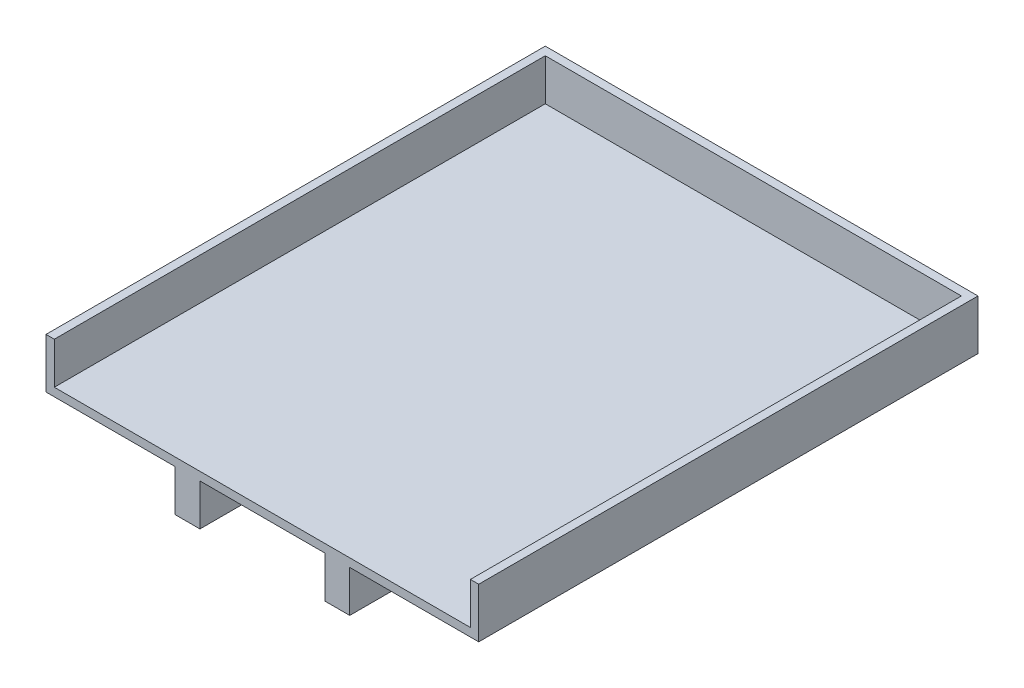
from build123d import *

# Parameters (mm, degrees)
BOSS_EXTRUDE1_DEPTH = 60
SKETCH2_W           = 50
SKETCH2_H           = 5
BOSS_EXTRUDE2_DEPTH = 1


with BuildPart() as part:
    # Sketch1 → Boss-Extrude1 (new body)
    with BuildSketch(Plane.XY):
        Polygon((-25, 0), (25, 0), (25, 5), (26, 5), (26, -1), (10.5, -1), (10.5, -6), (7.5, -6), (7.5, -1), (-7.5, -1), (-7.5, -6), (-10.5, -6), (-10.5, -1), (-26, -1), (-26, 5), (-25, 5), align=None)
    extrude(amount=BOSS_EXTRUDE1_DEPTH)

    # Sketch2 → Boss-Extrude2 (add)
    with BuildSketch(Plane(origin=(0, 0, 0), x_dir=(-1, 0, 0), z_dir=(0, 0, -1))):
        with Locations((0, 2.5)):
            Rectangle(SKETCH2_W, SKETCH2_H)
    extrude(amount=-BOSS_EXTRUDE2_DEPTH)


solid = part.part
